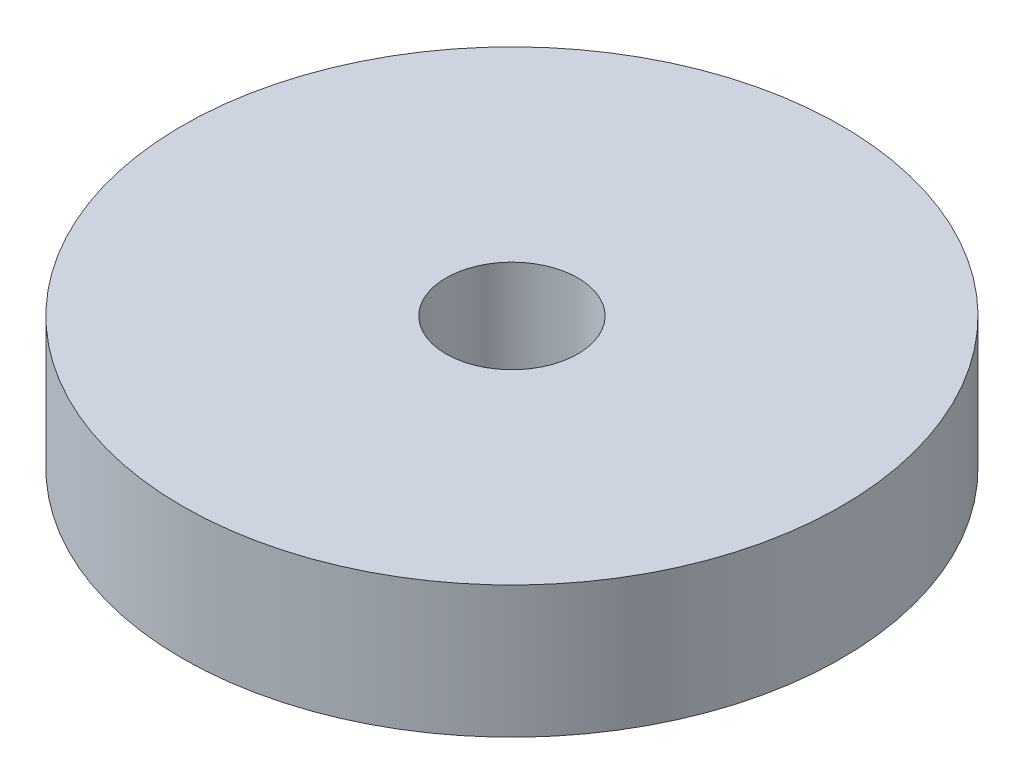
from build123d import *

# Parameters (mm, degrees)
SKETCH1_R           = 25
BOSS_EXTRUDE1_DEPTH = 10
SKETCH2_R           = 5
CUT_EXTRUDE1_DEPTH  = 10


with BuildPart() as part:
    # Sketch1 → Boss-Extrude1 (new body)
    with BuildSketch(Plane(origin=(0, 0, 0), x_dir=(1, 0, 0), z_dir=(0, 1, 0))):
        with Locations(Location((0, 0, 0), (0, 0, 270))):
            Circle(SKETCH1_R)
    extrude(amount=BOSS_EXTRUDE1_DEPTH)

    # Sketch2 → Cut-Extrude1 (cut)
    with BuildSketch(Plane(origin=(0, 10, 0), x_dir=(1, 0, 0), z_dir=(0, 1, 0))):
        with Locations(Location((0, 0, 0), (0, 0, 270))):
            Circle(SKETCH2_R)
    extrude(amount=-CUT_EXTRUDE1_DEPTH, mode=Mode.SUBTRACT)


solid = part.part
